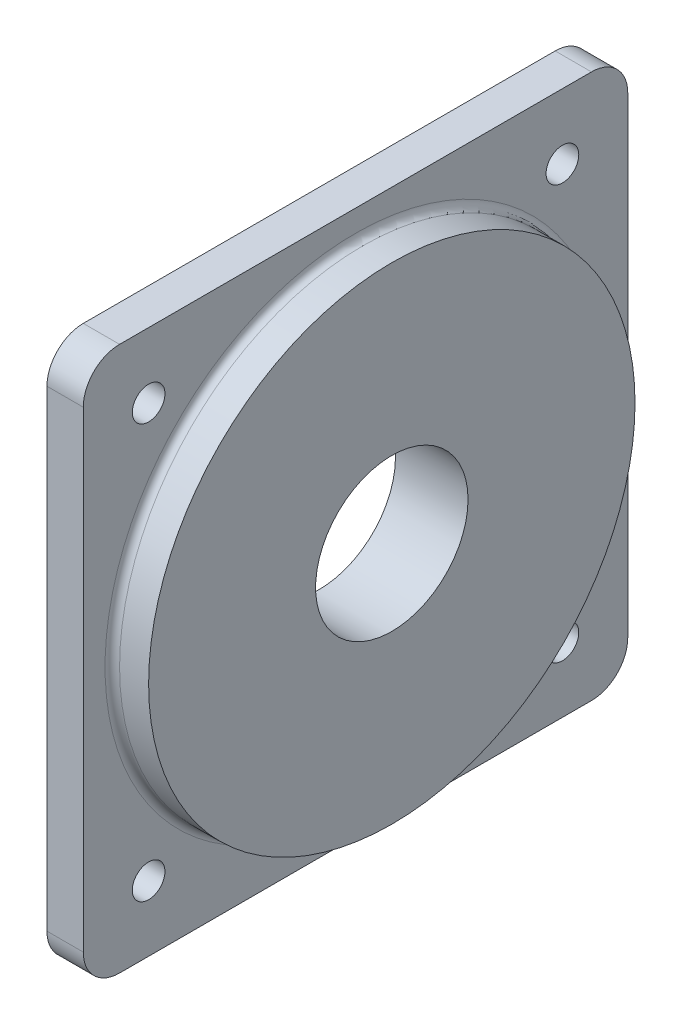
from build123d import *

# Parameters (mm, degrees)
CROQUIS1_W                   = 150
CROQUIS1_H                   = 150
SALIENTE_EXTRUIR1_DEPTH      = 10
CROQUIS2_R                   = 67
SALIENTE_EXTRUIR2_DEPTH      = 10
REDONDEO1_R                  = 10
REDONDEO2_R                  = 2
CROQUIS3_R                   = 21
CORTAR_EXTRUIR1_DEPTH        = 108.935165725
TALADRO_DE_MARGEN_PARA_M81_D = 9
TALADRO_DE_MARGEN_PARA_M82_D = 9


with BuildPart() as part:
    # Croquis1 → Saliente-Extruir1 (new body)
    with BuildSketch(Plane(origin=(0, 0, 0), x_dir=(0, 0, -1), z_dir=(1, 0, 0))):
        Rectangle(CROQUIS1_W, CROQUIS1_H)
    extrude(amount=SALIENTE_EXTRUIR1_DEPTH)

    # Croquis2 → Saliente-Extruir2 (add)
    with BuildSketch(Plane(origin=(10, 0, 0), x_dir=(0, 0, -1), z_dir=(1, 0, 0))):
        Circle(CROQUIS2_R)
    extrude(amount=SALIENTE_EXTRUIR2_DEPTH)

    # Redondeo1
    redondeo1_edges = [part.edges().sort_by_distance(p)[0] for p in [
        (5, -75, -75),
        (5, -75, 75),
        (5, 75, 75),
        (5, 75, -75),
    ]]
    fillet(redondeo1_edges, radius=REDONDEO1_R)

    # Redondeo2
    redondeo2_edges = [part.edges().sort_by_distance(p)[0] for p in [
        (10, 0, 67),
    ]]
    fillet(redondeo2_edges, radius=REDONDEO2_R)

    # Croquis3 → Cortar-Extruir1 (cut, through all)
    with BuildSketch(Plane(origin=(20, 0, 0), x_dir=(0, 0, -1), z_dir=(1, 0, 0))):
        Circle(CROQUIS3_R)
    extrude(amount=-CORTAR_EXTRUIR1_DEPTH, mode=Mode.SUBTRACT)

    # Taladro de margen para M81 (through all)
    with Locations(Plane(origin=(10, -7.41730184, 252.760845032), x_dir=(0, 0, -1), z_dir=(1, 0, 0))):
        with Locations((195.760845032, 64.41730184), (309.760845032, 64.41730184)):
            Hole(TALADRO_DE_MARGEN_PARA_M81_D / 2)

    # Taladro de margen para M82 (through all)
    with Locations(Plane(origin=(10, -7.41730184, 252.760845032), x_dir=(0, 0, -1), z_dir=(1, 0, 0))):
        with Locations((309.760845032, -49.58269816), (195.760845032, -49.58269816)):
            Hole(TALADRO_DE_MARGEN_PARA_M82_D / 2)


solid = part.part
